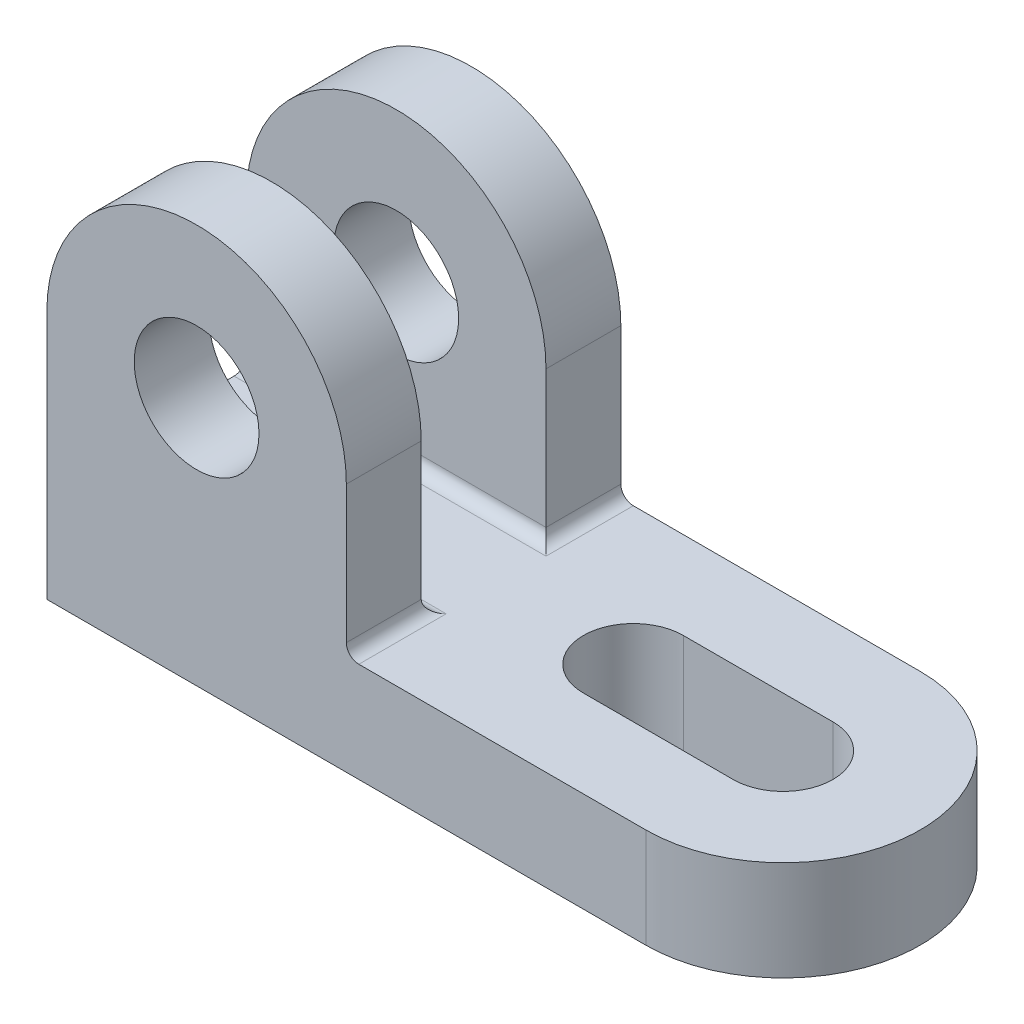
from build123d import *

# Parameters (mm, degrees)
SKETCH1_R           = 22
BOSS_EXTRUDE1_DEPTH = 16
CUT_EXTRUDE1_DEPTH  = 16
BOSS_EXTRUDE2_DEPTH = 12
FILLET1_R           = 2


with BuildPart() as part:
    # Sketch1 → Boss-Extrude1 (new body)
    with BuildSketch(Plane(origin=(0, 0, 0), x_dir=(1, 0, 0), z_dir=(0, 1, 0))):
        with BuildLine():
            Line((-59, 22), (-59, -22))
            Line((-59, -22), (37, -22))
            ThreePointArc((37, -22), (15, 3.2e-08), (37.000000064, 22))
            Line((37.000000064, 22), (-59, 22))
        make_face()
        with Locations((37, 0)):
            Circle(SKETCH1_R)
    extrude(amount=BOSS_EXTRUDE1_DEPTH)

    # Sketch2 → Cut-Extrude1 (cut)
    with BuildSketch(Plane(origin=(0, 16, 0), x_dir=(1, 0, 0), z_dir=(0, 1, 0))):
        with BuildLine():
            Line((37, -8), (13, -8))
            ThreePointArc((13, -8), (5, 0), (13, 8))
            Line((13, 8), (37, 8))
            ThreePointArc((37, 8), (45, 0), (37, -8))
        make_face()
    extrude(amount=-CUT_EXTRUDE1_DEPTH, mode=Mode.SUBTRACT)

    # Sketch3 → Boss-Extrude2 (add)
    with BuildSketch(Plane.XY.offset(22)):
        with BuildLine():
            Line((-59, 40), (-59, 16))
            Line((-59, 16), (-35, 16))
            ThreePointArc((-35, 16), (-51.970562748, 23.029437252), (-59, 40))
        make_face()
        with BuildLine():
            ThreePointArc((-11, 40), (-18.029437252, 23.029437252), (-35, 16))
            Line((-35, 16), (-11, 16))
            Line((-11, 16), (-11, 40))
        make_face()
        with BuildLine():
            ThreePointArc((-59, 40), (-51.970562748, 23.029437252), (-35, 16))
            ThreePointArc((-35, 16), (-18.029437252, 23.029437252), (-11, 40))
            Line((-11, 40), (-25, 40))
            ThreePointArc((-25, 40), (-35, 30), (-45, 40))
            Line((-45, 40), (-59, 40))
        make_face()
        with BuildLine():
            ThreePointArc((-11, 40), (-35, 64), (-59, 40))
            Line((-59, 40), (-45, 40))
            ThreePointArc((-45, 40), (-35, 50), (-25, 40))
            Line((-25, 40), (-11, 40))
        make_face()
    boss_extrude2 = extrude(amount=-BOSS_EXTRUDE2_DEPTH)

    # Mirror1: Boss-Extrude2 across plane
    add(boss_extrude2.mirror(Plane.XY))

    # Fillet1
    fillet1_edges = [part.edges().sort_by_distance(p)[0] for p in [
        (-11, 16, 16),
        (-35, 16, 10),
        (-35, 16, -10),
        (-11, 16, -16),
    ]]
    fillet(fillet1_edges, radius=FILLET1_R)


solid = part.part
